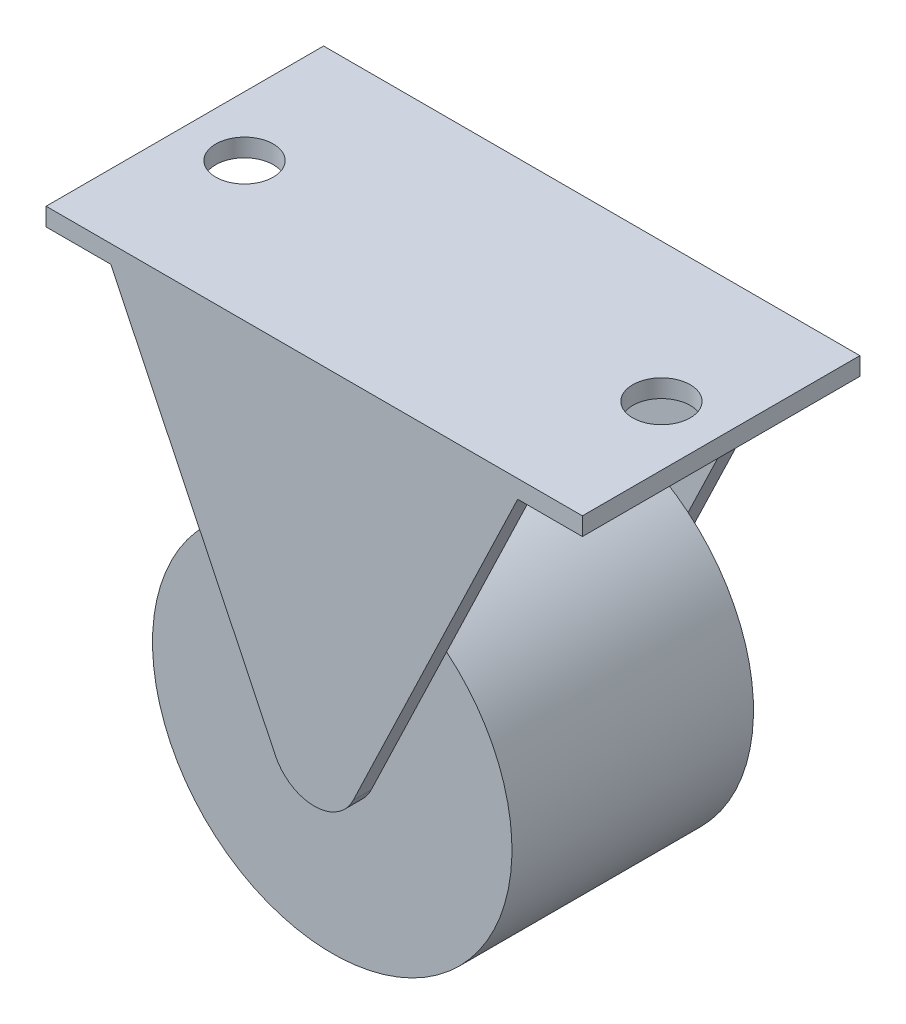
from build123d import *

# Parameters (mm, degrees)
SKETCH1_W           = 37.3
SKETCH1_H           = 19.3
SKETCH1_R           = 2
BOSS_EXTRUDE1_DEPTH = 1.25
BOSS_EXTRUDE2_DEPTH = 1.25
BOSS_EXTRUDE3_START = -18.05
BOSS_EXTRUDE3_DEPTH = 1.25
SKETCH3_R           = 12.5
BOSS_EXTRUDE4_DEPTH = 16.8


with BuildPart() as part:
    # Sketch1 → Boss-Extrude1 (new body)
    with BuildSketch(Plane(origin=(0, 0, 0), x_dir=(1, 0, 0), z_dir=(0, 1, 0))):
        Rectangle(SKETCH1_W, SKETCH1_H)
        with Locations(Location((-14.5, 0, 0), (0, 0, 270))):
            Circle(SKETCH1_R, mode=Mode.SUBTRACT)
        with Locations(Location((14.5, 0, 0), (0, 0, 90))):
            Circle(SKETCH1_R, mode=Mode.SUBTRACT)
    extrude(amount=BOSS_EXTRUDE1_DEPTH)

    # Sketch2 → Boss-Extrude2 (add)
    with BuildSketch(Plane.XY.offset(9.65)):
        with BuildLine():
            Line((-14.15, 0), (14.15, 0))
            Line((14.15, 0), (2.704926778, -23.860753361))
            ThreePointArc((2.704926778, -23.860753361), (0, -25.563305432), (-2.704926778, -23.860753361))
            Line((-2.704926778, -23.860753361), (-14.15, 0))
        make_face()
    extrude(amount=-BOSS_EXTRUDE2_DEPTH)

    # Sketch2<2> → Boss-Extrude3 (add)
    with BuildSketch(Plane.XY.offset(9.65).offset(BOSS_EXTRUDE3_START)):
        with BuildLine():
            Line((-14.15, 0), (14.15, 0))
            Line((14.15, 0), (2.704926778, -23.860753361))
            ThreePointArc((2.704926778, -23.860753361), (0, -25.563305432), (-2.704926778, -23.860753361))
            Line((-2.704926778, -23.860753361), (-14.15, 0))
        make_face()
    extrude(amount=-BOSS_EXTRUDE3_DEPTH)

    # Sketch3 → Boss-Extrude4 (add)
    with BuildSketch(Plane(origin=(0, 0, 8.4), x_dir=(-1, 0, 0), z_dir=(0, 0, -1))):
        with Locations(Location((0, -22.563305432, 0), (0, 0, 129.511758747))):
            Circle(SKETCH3_R)
    extrude(amount=BOSS_EXTRUDE4_DEPTH)


solid = part.part
